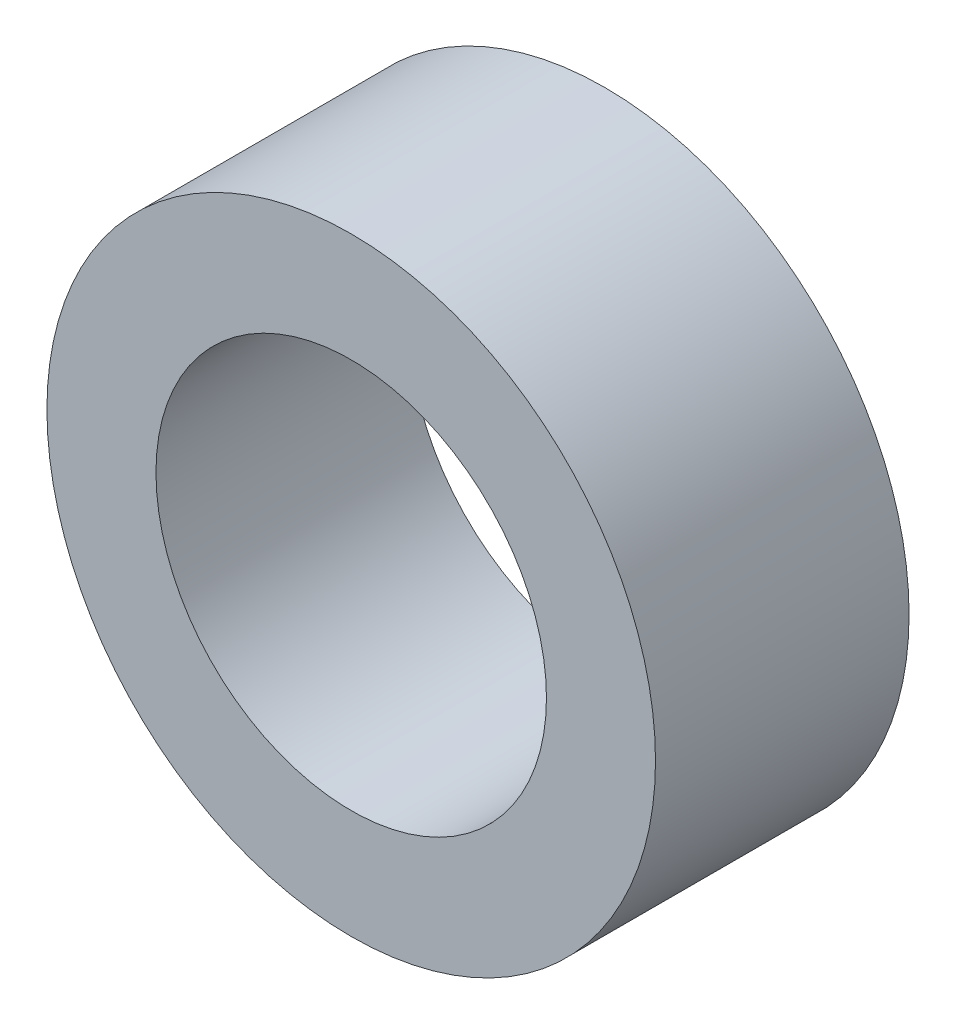
from build123d import *

# Parameters (mm, degrees)
SKETCH1_R           = 6
SKETCH1_R_2         = 3.85
BOSS_EXTRUDE1_DEPTH = 5


with BuildPart() as part:
    # Sketch1 → Boss-Extrude1 (new body)
    with BuildSketch(Plane.XY):
        Circle(SKETCH1_R)
        Circle(SKETCH1_R_2, mode=Mode.SUBTRACT)
    extrude(amount=BOSS_EXTRUDE1_DEPTH)


solid = part.part
